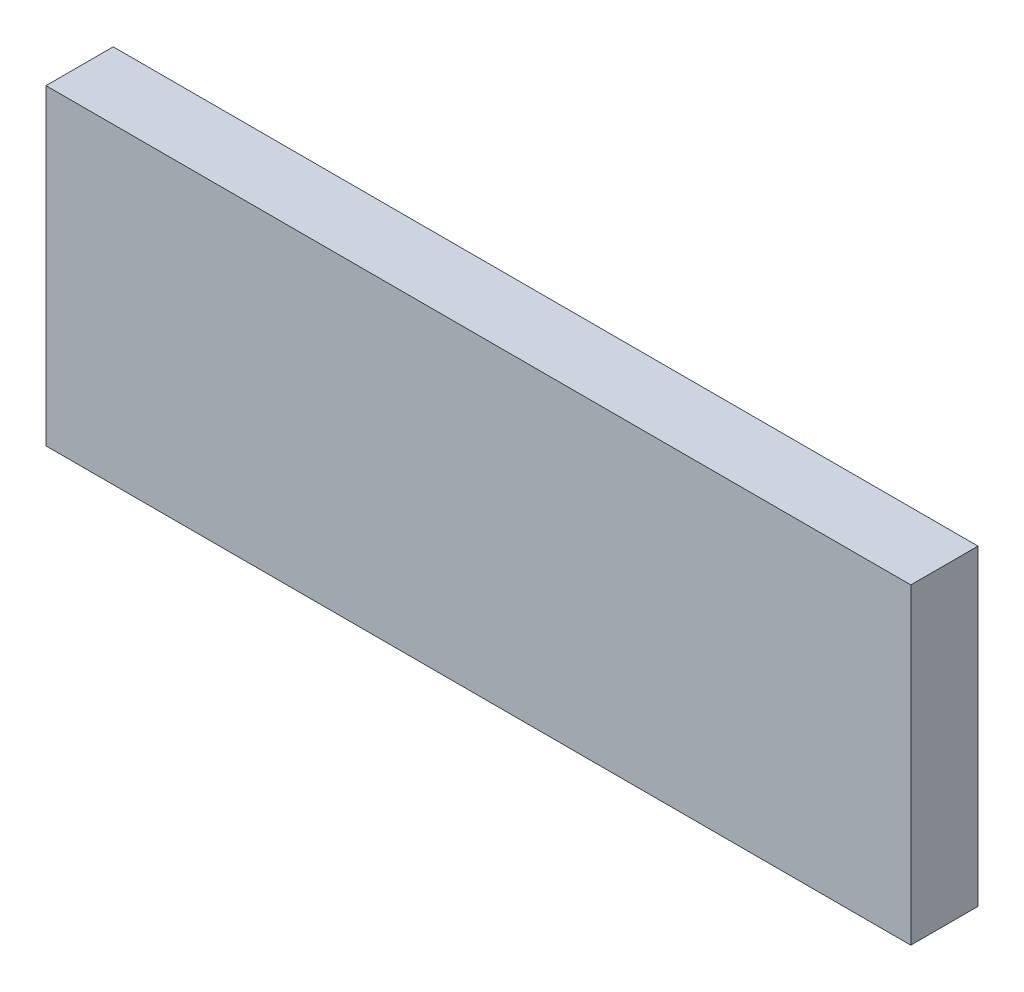
from build123d import *

# Parameters (mm, degrees)
ESQUISSE1_W        = 75.19
ESQUISSE1_H        = 27.85
BOSS_EXTRU_1_DEPTH = 6
ESQUISSE2_W        = 6
ESQUISSE2_H        = 27.85
BOSS_EXTRU_2_DEPTH = 2


with BuildPart() as part:
    # Esquisse1 → Boss.-Extru.1 (new body)
    with BuildSketch(Plane.XY):
        with Locations((0.892959691, 7.485531136)):
            Rectangle(ESQUISSE1_W, ESQUISSE1_H)
    extrude(amount=BOSS_EXTRU_1_DEPTH)

    # Esquisse2 → Boss.-Extru.2 (add)
    with BuildSketch(Plane(origin=(38.487959691, 0, 0), x_dir=(0, 0, -1), z_dir=(1, 0, 0))):
        with Locations((-3, 7.485531136)):
            Rectangle(ESQUISSE2_W, ESQUISSE2_H)
    extrude(amount=BOSS_EXTRU_2_DEPTH)


solid = part.part
